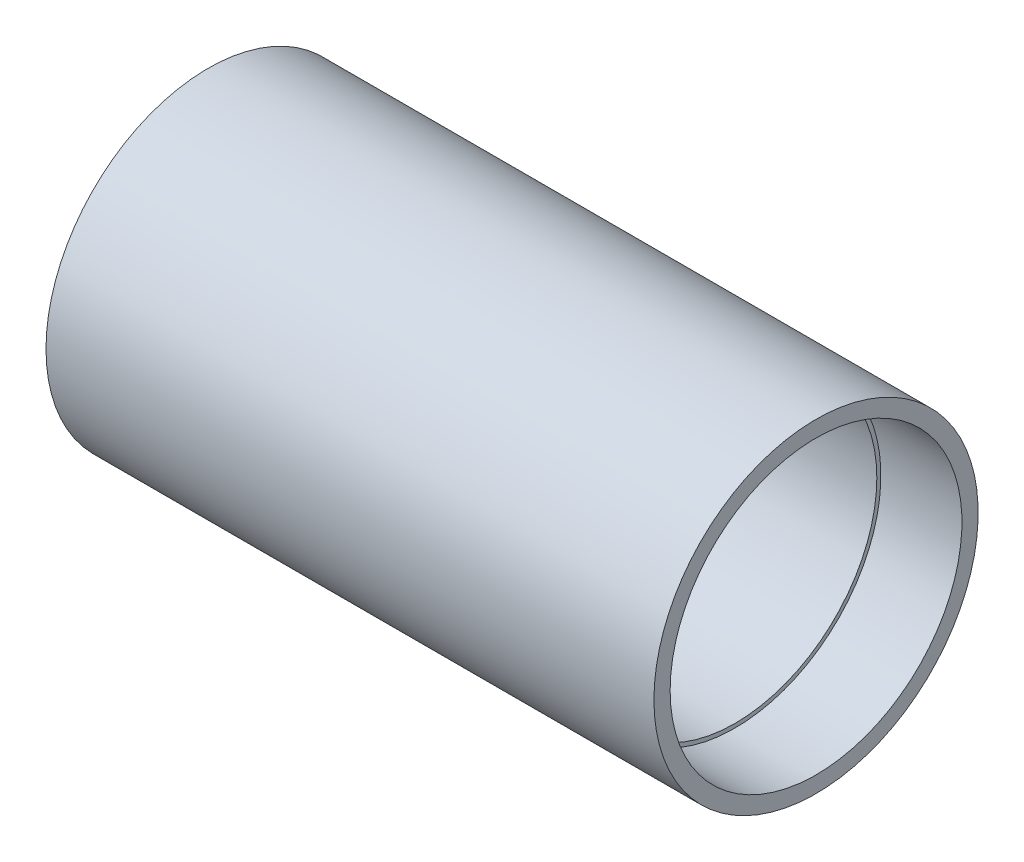
from build123d import *


with BuildPart() as part:
    # Çizim1 → Döndür1 (revolve)
    with BuildSketch(Plane.XY, mode=Mode.PRIVATE) as d_nd_r1_sk:
        Polygon((-150, 40), (0, 40), (0, 36), (-20, 36), (-20, 35), (-130, 35), (-130, 36), (-150, 36), align=None)
    revolve(d_nd_r1_sk.sketch.rotate(Axis((-88.99, 0, 0), (1, 0, 0)), 90), axis=Axis((-88.99, 0, 0), (1, 0, 0)))


solid = part.part
